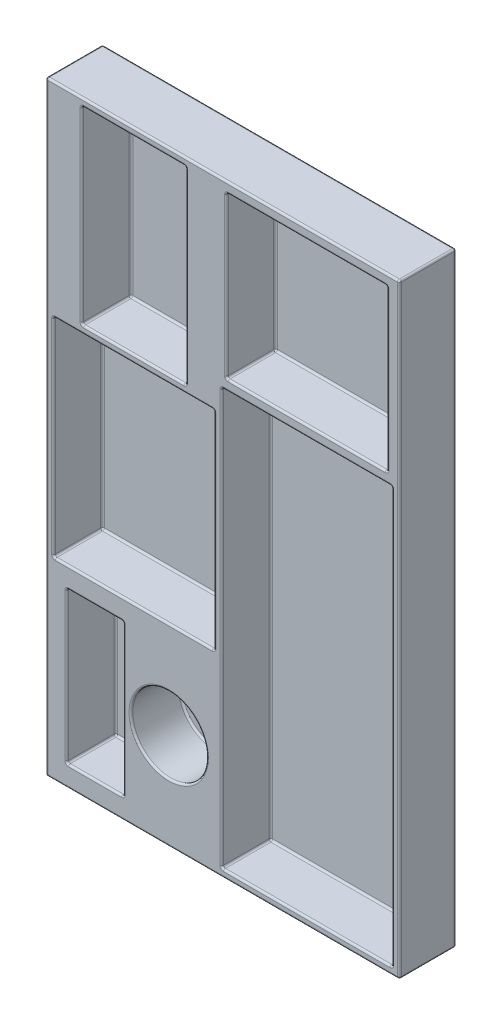
from build123d import *

# Parameters (mm, degrees)
SKETCH1_W           = 187
SKETCH1_H           = 320
BOSS_EXTRUDE1_DEPTH = 30
SKETCH3_W           = 90
SKETCH3_H           = 220
CUT_EXTRUDE1_DEPTH  = 26
SKETCH4_W           = 85
SKETCH4_H           = 85
CUT_EXTRUDE2_DEPTH  = 26
SKETCH5_W           = 55
SKETCH5_H           = 100
CUT_EXTRUDE3_DEPTH  = 26
SKETCH6_W           = 85
SKETCH6_H           = 110
CUT_EXTRUDE4_DEPTH  = 26
SKETCH7_R           = 20
SKETCH7_W           = 30
SKETCH7_H           = 80
CUT_EXTRUDE6_DEPTH  = 26
FILLET1_R           = 1


with BuildPart() as part:
    # Sketch1 → Boss-Extrude1 (new body)
    with BuildSketch(Plane.XY):
        Rectangle(SKETCH1_W, SKETCH1_H)
    extrude(amount=BOSS_EXTRUDE1_DEPTH)

    # Sketch3 → Cut-Extrude1 (cut)
    with BuildSketch(Plane.XY.offset(30)):
        with Locations((44.5, -46)):
            Rectangle(SKETCH3_W, SKETCH3_H)
    extrude(amount=-CUT_EXTRUDE1_DEPTH, mode=Mode.SUBTRACT)

    # Sketch4 → Cut-Extrude2 (cut)
    with BuildSketch(Plane.XY.offset(30)):
        with Locations((44.5, 112)):
            Rectangle(SKETCH4_W, SKETCH4_H)
    extrude(amount=-CUT_EXTRUDE2_DEPTH, mode=Mode.SUBTRACT)

    # Sketch5 → Cut-Extrude3 (cut)
    with BuildSketch(Plane.XY.offset(30)):
        with Locations((-47, 106)):
            Rectangle(SKETCH5_W, SKETCH5_H)
    extrude(amount=-CUT_EXTRUDE3_DEPTH, mode=Mode.SUBTRACT)

    # Sketch6 → Cut-Extrude4 (cut)
    with BuildSketch(Plane.XY.offset(30)):
        with Locations((-47, -3)):
            Rectangle(SKETCH6_W, SKETCH6_H)
    extrude(amount=-CUT_EXTRUDE4_DEPTH, mode=Mode.SUBTRACT)

    # Sketch7 → Cut-Extrude6 (cut)
    with BuildSketch(Plane.XY.offset(30)):
        with Locations((-28.5, -109)):
            Circle(SKETCH7_R)
        with Locations((-67.5, -109)):
            Rectangle(SKETCH7_W, SKETCH7_H)
    extrude(amount=-CUT_EXTRUDE6_DEPTH, mode=Mode.SUBTRACT)

    # Fillet1
    fillet1_edges = [part.edges().sort_by_distance(p)[0] for p in [
        (93.5, 0, 30),
        (-0.5, -46, 4),
        (-0.5, -156, 17),
        (44.5, 64, 4),
        (-0.5, 64, 17),
        (89.5, -46, 4),
        (0, 160, 30),
        (89.5, 64, 17),
        (44.5, -156, 4),
        (89.5, -156, 17),
        (-0.5, -46, 30),
        (44.5, -156, 30),
        (89.5, -46, 30),
        (44.5, 64, 30),
        (2, 112, 4),
        (2, 69.5, 17),
        (44.5, 154.5, 4),
        (2, 154.5, 17),
        (87, 112, 4),
        (87, 154.5, 17),
        (44.5, 69.5, 4),
        (87, 69.5, 17),
        (2, 112, 30),
        (44.5, 69.5, 30),
        (87, 112, 30),
        (44.5, 154.5, 30),
        (-74.5, 106, 4),
        (-74.5, 56, 17),
        (-47, 156, 4),
        (-74.5, 156, 17),
        (-19.5, 106, 4),
        (-19.5, 156, 17),
        (-47, 56, 4),
        (-19.5, 56, 17),
        (-74.5, 106, 30),
        (-47, 56, 30),
        (-19.5, 106, 30),
        (-47, 156, 30),
        (-93.5, 0, 30),
        (0, 160, 0),
        (93.5, 0, 0),
        (-89.5, -3, 4),
        (0, -160, 0),
        (-89.5, -58, 17),
        (-47, 52, 4),
        (-89.5, 52, 17),
        (-4.5, -3, 4),
        (-4.5, 52, 17),
        (-47, -58, 4),
        (-4.5, -58, 17),
        (-89.5, -3, 30),
        (-47, -58, 30),
        (-4.5, -3, 30),
        (-47, 52, 30),
        (-93.5, 0, 0),
        (-48.5, -109, 4),
        (-48.5, -109, 30),
        (-82.5, -109, 4),
        (-82.5, -149, 17),
        (-67.5, -69, 4),
        (-82.5, -69, 17),
        (-52.5, -109, 4),
        (-52.5, -69, 17),
        (-67.5, -149, 4),
        (-52.5, -149, 17),
        (-82.5, -109, 30),
        (-67.5, -149, 30),
        (-52.5, -109, 30),
        (-67.5, -69, 30),
        (-93.5, 160, 15),
        (93.5, 160, 15),
        (93.5, -160, 15),
        (-93.5, -160, 15),
        (0, -160, 30),
    ]]
    fillet(fillet1_edges, radius=FILLET1_R)


solid = part.part
